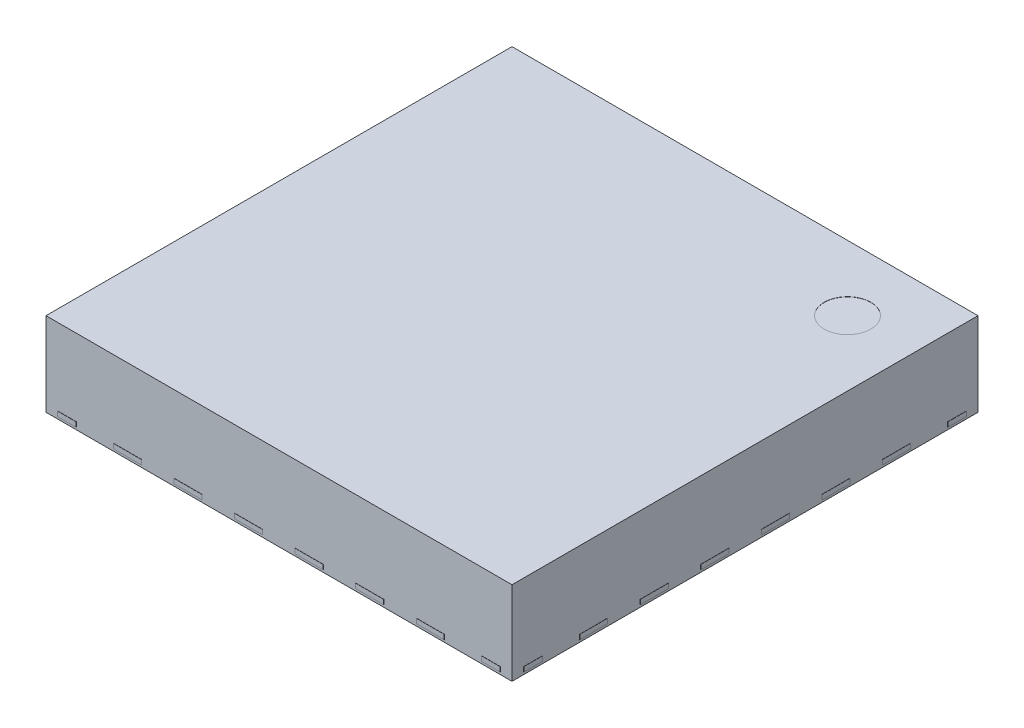
from build123d import *

# Parameters (mm, degrees)
EXTRUDE1_START           = 0.002
SKETCH1_W                = 5
SKETCH1_H                = 5
EXTRUDE1_DEPTH           = 0.898
EXTRUDE2_DEPTH           = 0.002
EXTRUDE3_DEPTH           = 0.002
EXTRUDE5_START           = -0.025
SKETCH6_W                = 0.3
SKETCH6_H                = 0.002
EXTRUDE5_DEPTH           = 0.05
EXTRUDE6_START           = 0.025
SKETCH7_W                = 0.002
SKETCH7_H                = 0.3
EXTRUDE6_DEPTH           = 0.05
LPATTERN1_COUNT          = 4
LPATTERN1_PITCH          = 0.65
LPATTERN1_COL_COUNT      = 5
LPATTERN1_COL_PITCH      = 0.65
LPATTERN2_COUNT          = 4
LPATTERN2_PITCH          = 0.65
LPATTERN2_COL_COUNT      = 5
LPATTERN2_COL_PITCH      = 0.65
MIRROR1_COPY_1_DEPTH     = 0.002
MIRROR1_COPY_2_DEPTH     = 0.002
MIRROR1_COPY_3_DEPTH     = 0.002
MIRROR1_START            = -0.025
MIRROR1_COPY_4_SKETCH_W  = 0.3
MIRROR1_COPY_4_SKETCH_H  = 0.002
MIRROR1_COPY_4_DEPTH     = 0.05
MIRROR1_COPY_5_SKETCH_W  = 0.3
MIRROR1_COPY_5_SKETCH_H  = 0.002
MIRROR1_COPY_5_DEPTH     = 0.05
MIRROR1_COPY_6_SKETCH_W  = 0.3
MIRROR1_COPY_6_SKETCH_H  = 0.002
MIRROR1_COPY_6_DEPTH     = 0.05
MIRROR1_COPY_7_DEPTH     = 0.002
MIRROR1_COPY_8_DEPTH     = 0.002
MIRROR1_COPY_9_DEPTH     = 0.002
MIRROR1_COPY_10_DEPTH    = 0.002
MIRROR1_COPY_11_SKETCH_W = 0.3
MIRROR1_COPY_11_SKETCH_H = 0.002
MIRROR1_COPY_11_DEPTH    = 0.05
MIRROR1_COPY_12_SKETCH_W = 0.3
MIRROR1_COPY_12_SKETCH_H = 0.002
MIRROR1_COPY_12_DEPTH    = 0.05
MIRROR1_COPY_13_SKETCH_W = 0.3
MIRROR1_COPY_13_SKETCH_H = 0.002
MIRROR1_COPY_13_DEPTH    = 0.05
MIRROR1_COPY_14_SKETCH_W = 0.3
MIRROR1_COPY_14_SKETCH_H = 0.002
MIRROR1_COPY_14_DEPTH    = 0.05
MIRROR2_COPY_1_DEPTH     = 0.002
MIRROR2_COPY_2_DEPTH     = 0.002
MIRROR2_COPY_3_DEPTH     = 0.002
MIRROR2_START            = 0.025
MIRROR2_COPY_4_SKETCH_W  = 0.002
MIRROR2_COPY_4_SKETCH_H  = 0.3
MIRROR2_COPY_4_DEPTH     = 0.05
MIRROR2_COPY_5_SKETCH_W  = 0.002
MIRROR2_COPY_5_SKETCH_H  = 0.3
MIRROR2_COPY_5_DEPTH     = 0.05
MIRROR2_COPY_6_SKETCH_W  = 0.002
MIRROR2_COPY_6_SKETCH_H  = 0.3
MIRROR2_COPY_6_DEPTH     = 0.05
MIRROR2_COPY_7_DEPTH     = 0.002
MIRROR2_COPY_8_DEPTH     = 0.002
MIRROR2_COPY_9_DEPTH     = 0.002
MIRROR2_COPY_10_DEPTH    = 0.002
MIRROR2_COPY_11_SKETCH_W = 0.002
MIRROR2_COPY_11_SKETCH_H = 0.3
MIRROR2_COPY_11_DEPTH    = 0.05
MIRROR2_COPY_12_SKETCH_W = 0.002
MIRROR2_COPY_12_SKETCH_H = 0.3
MIRROR2_COPY_12_DEPTH    = 0.05
MIRROR2_COPY_13_SKETCH_W = 0.002
MIRROR2_COPY_13_SKETCH_H = 0.3
MIRROR2_COPY_13_DEPTH    = 0.05
MIRROR2_COPY_14_SKETCH_W = 0.002
MIRROR2_COPY_14_SKETCH_H = 0.3
MIRROR2_COPY_14_DEPTH    = 0.05
EXTRUDE4_DEPTH           = 0.002
SKETCH5_R                = 0.25
CUT_EXTRUDE1_DEPTH       = 0.002
SKETCH11_W               = 0.05
SKETCH11_H               = 0.05
CUT_EXTRUDE5_DEPTH       = 0.002
SKETCH13_W               = 0.05
SKETCH13_H               = 0.05
CUT_EXTRUDE6_DEPTH       = 0.002


with BuildPart() as part:
    # Sketch1 → Extrude1 (new body)
    with BuildSketch(Plane(origin=(0, 0, 0), x_dir=(1, 0, 0), z_dir=(0, 1, 0)).offset(EXTRUDE1_START)):
        Rectangle(SKETCH1_W, SKETCH1_H)
    extrude(amount=EXTRUDE1_DEPTH)

    # Sketch2 → Extrude2 (add)
    with BuildSketch(Plane(origin=(0, 0, 0), x_dir=(1, 0, 0), z_dir=(0, 1, 0))):
        with BuildLine():
            Line((0.175, 2.4425), (0.475, 2.4425))
            Line((0.475, 2.4425), (0.475, 2.255))
            ThreePointArc((0.475, 2.255), (0.325, 2.105), (0.175, 2.255))
            Line((0.175, 2.255), (0.175, 2.4425))
        make_face()
    extrude2 = extrude(amount=EXTRUDE2_DEPTH)

    # Sketch3 → Extrude3 (add)
    with BuildSketch(Plane(origin=(0, 0, 0), x_dir=(1, 0, 0), z_dir=(0, 1, 0))):
        with BuildLine():
            Line((-2.4425, 0.175), (-2.1425, 0.175))
            ThreePointArc((-2.1425, 0.175), (-1.9925, 0.325), (-2.1425, 0.475))
            Line((-2.1425, 0.475), (-2.4425, 0.475))
            Line((-2.4425, 0.475), (-2.4425, 0.175))
        make_face()
    extrude3 = extrude(amount=EXTRUDE3_DEPTH)

    # Sketch6 → Extrude5 (add)
    with BuildSketch(Plane(origin=(0, 0.002, 0), x_dir=(-1, 0, 0), z_dir=(0, -1, 0)).offset(EXTRUDE5_START)):
        with Locations((-0.325, 2.501)):
            Rectangle(SKETCH6_W, SKETCH6_H)
    extrude5 = extrude(amount=-EXTRUDE5_DEPTH)

    # Sketch7 → Extrude6 (add)
    with BuildSketch(Plane(origin=(0, 0.002, 0), x_dir=(1, 0, 0), z_dir=(0, 1, 0)).offset(EXTRUDE6_START)):
        with Locations((-2.501, 0.325)):
            Rectangle(SKETCH7_W, SKETCH7_H)
    extrude6 = extrude(amount=EXTRUDE6_DEPTH)

    # LPattern1: Extrude2, Extrude5 ×4
    with Locations(*[(i * LPATTERN1_PITCH, 0, 0) for i in range(1, LPATTERN1_COUNT)]):
        add(extrude2)
        add(extrude5)

    # LPattern1 col: Extrude2, Extrude5 ×5
    with Locations(*[(-i * LPATTERN1_COL_PITCH, 0, 0) for i in range(1, LPATTERN1_COL_COUNT)]):
        add(extrude2)
        add(extrude5)

    # LPattern2: Extrude3, Extrude6 ×4
    with Locations(*[(0, 0, -i * LPATTERN2_PITCH) for i in range(1, LPATTERN2_COUNT)]):
        add(extrude3)
        add(extrude6)

    # LPattern2 col: Extrude3, Extrude6 ×5
    with Locations(*[(0, 0, i * LPATTERN2_COL_PITCH) for i in range(1, LPATTERN2_COL_COUNT)]):
        add(extrude3)
        add(extrude6)

    # Mirror1: Extrude2, Extrude5 across plane
    add(extrude2.mirror(Plane.XY))
    add(extrude5.mirror(Plane.XY))

    # Mirror1 copy 1 sketch → Mirror1 copy 1 (add)
    with BuildSketch(Plane(origin=(0.65, 0, 0), x_dir=(1, 0, 0), z_dir=(0, 1, 0))):
        with BuildLine():
            Line((0.175, -2.4425), (0.475, -2.4425))
            Line((0.475, -2.4425), (0.475, -2.255))
            ThreePointArc((0.475, -2.255), (0.325, -2.105), (0.175, -2.255))
            Line((0.175, -2.255), (0.175, -2.4425))
        make_face()
    extrude(amount=MIRROR1_COPY_1_DEPTH)

    # Mirror1 copy 2 sketch → Mirror1 copy 2 (add)
    with BuildSketch(Plane(origin=(1.3, 0, 0), x_dir=(1, 0, 0), z_dir=(0, 1, 0))):
        with BuildLine():
            Line((0.175, -2.4425), (0.475, -2.4425))
            Line((0.475, -2.4425), (0.475, -2.255))
            ThreePointArc((0.475, -2.255), (0.325, -2.105), (0.175, -2.255))
            Line((0.175, -2.255), (0.175, -2.4425))
        make_face()
    extrude(amount=MIRROR1_COPY_2_DEPTH)

    # Mirror1 copy 3 sketch → Mirror1 copy 3 (add)
    with BuildSketch(Plane(origin=(1.95, 0, 0), x_dir=(1, 0, 0), z_dir=(0, 1, 0))):
        with BuildLine():
            Line((0.175, -2.4425), (0.475, -2.4425))
            Line((0.475, -2.4425), (0.475, -2.255))
            ThreePointArc((0.475, -2.255), (0.325, -2.105), (0.175, -2.255))
            Line((0.175, -2.255), (0.175, -2.4425))
        make_face()
    extrude(amount=MIRROR1_COPY_3_DEPTH)

    # Mirror1 copy 4 sketch → Mirror1 copy 4 (add)
    with BuildSketch(Plane(origin=(0.65, 0.002, 0), x_dir=(-1, 0, 0), z_dir=(0, -1, 0)).offset(MIRROR1_START)):
        with Locations((-0.325, -2.501)):
            Rectangle(MIRROR1_COPY_4_SKETCH_W, MIRROR1_COPY_4_SKETCH_H)
    extrude(amount=-MIRROR1_COPY_4_DEPTH)

    # Mirror1 copy 5 sketch → Mirror1 copy 5 (add)
    with BuildSketch(Plane(origin=(1.3, 0.002, 0), x_dir=(-1, 0, 0), z_dir=(0, -1, 0)).offset(MIRROR1_START)):
        with Locations((-0.325, -2.501)):
            Rectangle(MIRROR1_COPY_5_SKETCH_W, MIRROR1_COPY_5_SKETCH_H)
    extrude(amount=-MIRROR1_COPY_5_DEPTH)

    # Mirror1 copy 6 sketch → Mirror1 copy 6 (add)
    with BuildSketch(Plane(origin=(1.95, 0.002, 0), x_dir=(-1, 0, 0), z_dir=(0, -1, 0)).offset(MIRROR1_START)):
        with Locations((-0.325, -2.501)):
            Rectangle(MIRROR1_COPY_6_SKETCH_W, MIRROR1_COPY_6_SKETCH_H)
    extrude(amount=-MIRROR1_COPY_6_DEPTH)

    # Mirror1 copy 7 sketch → Mirror1 copy 7 (add)
    with BuildSketch(Plane(origin=(-0.65, 0, 0), x_dir=(1, 0, 0), z_dir=(0, 1, 0))):
        with BuildLine():
            Line((0.175, -2.4425), (0.475, -2.4425))
            Line((0.475, -2.4425), (0.475, -2.255))
            ThreePointArc((0.475, -2.255), (0.325, -2.105), (0.175, -2.255))
            Line((0.175, -2.255), (0.175, -2.4425))
        make_face()
    extrude(amount=MIRROR1_COPY_7_DEPTH)

    # Mirror1 copy 8 sketch → Mirror1 copy 8 (add)
    with BuildSketch(Plane(origin=(-1.3, 0, 0), x_dir=(1, 0, 0), z_dir=(0, 1, 0))):
        with BuildLine():
            Line((0.175, -2.4425), (0.475, -2.4425))
            Line((0.475, -2.4425), (0.475, -2.255))
            ThreePointArc((0.475, -2.255), (0.325, -2.105), (0.175, -2.255))
            Line((0.175, -2.255), (0.175, -2.4425))
        make_face()
    extrude(amount=MIRROR1_COPY_8_DEPTH)

    # Mirror1 copy 9 sketch → Mirror1 copy 9 (add)
    with BuildSketch(Plane(origin=(-1.95, 0, 0), x_dir=(1, 0, 0), z_dir=(0, 1, 0))):
        with BuildLine():
            Line((0.175, -2.4425), (0.475, -2.4425))
            Line((0.475, -2.4425), (0.475, -2.255))
            ThreePointArc((0.475, -2.255), (0.325, -2.105), (0.175, -2.255))
            Line((0.175, -2.255), (0.175, -2.4425))
        make_face()
    extrude(amount=MIRROR1_COPY_9_DEPTH)

    # Mirror1 copy 10 sketch → Mirror1 copy 10 (add)
    with BuildSketch(Plane(origin=(-2.6, 0, 0), x_dir=(1, 0, 0), z_dir=(0, 1, 0))):
        with BuildLine():
            Line((0.175, -2.4425), (0.475, -2.4425))
            Line((0.475, -2.4425), (0.475, -2.255))
            ThreePointArc((0.475, -2.255), (0.325, -2.105), (0.175, -2.255))
            Line((0.175, -2.255), (0.175, -2.4425))
        make_face()
    extrude(amount=MIRROR1_COPY_10_DEPTH)

    # Mirror1 copy 11 sketch → Mirror1 copy 11 (add)
    with BuildSketch(Plane(origin=(-0.65, 0.002, 0), x_dir=(-1, 0, 0), z_dir=(0, -1, 0)).offset(MIRROR1_START)):
        with Locations((-0.325, -2.501)):
            Rectangle(MIRROR1_COPY_11_SKETCH_W, MIRROR1_COPY_11_SKETCH_H)
    extrude(amount=-MIRROR1_COPY_11_DEPTH)

    # Mirror1 copy 12 sketch → Mirror1 copy 12 (add)
    with BuildSketch(Plane(origin=(-1.3, 0.002, 0), x_dir=(-1, 0, 0), z_dir=(0, -1, 0)).offset(MIRROR1_START)):
        with Locations((-0.325, -2.501)):
            Rectangle(MIRROR1_COPY_12_SKETCH_W, MIRROR1_COPY_12_SKETCH_H)
    extrude(amount=-MIRROR1_COPY_12_DEPTH)

    # Mirror1 copy 13 sketch → Mirror1 copy 13 (add)
    with BuildSketch(Plane(origin=(-1.95, 0.002, 0), x_dir=(-1, 0, 0), z_dir=(0, -1, 0)).offset(MIRROR1_START)):
        with Locations((-0.325, -2.501)):
            Rectangle(MIRROR1_COPY_13_SKETCH_W, MIRROR1_COPY_13_SKETCH_H)
    extrude(amount=-MIRROR1_COPY_13_DEPTH)

    # Mirror1 copy 14 sketch → Mirror1 copy 14 (add)
    with BuildSketch(Plane(origin=(-2.6, 0.002, 0), x_dir=(-1, 0, 0), z_dir=(0, -1, 0)).offset(MIRROR1_START)):
        with Locations((-0.325, -2.501)):
            Rectangle(MIRROR1_COPY_14_SKETCH_W, MIRROR1_COPY_14_SKETCH_H)
    extrude(amount=-MIRROR1_COPY_14_DEPTH)

    # Mirror2: Extrude3, Extrude6 across plane
    add(extrude3.mirror(Plane(origin=(0, 0, 0), x_dir=(0, 0, 1), z_dir=(1, 0, 0))))
    add(extrude6.mirror(Plane(origin=(0, 0, 0), x_dir=(0, 0, 1), z_dir=(1, 0, 0))))

    # Mirror2 copy 1 sketch → Mirror2 copy 1 (add)
    with BuildSketch(Plane(origin=(0, 0, -0.65), x_dir=(-1, 0, 0), z_dir=(0, 1, 0))):
        with BuildLine():
            Line((-2.4425, -0.175), (-2.1425, -0.175))
            ThreePointArc((-2.1425, -0.175), (-1.9925, -0.325), (-2.1425, -0.475))
            Line((-2.1425, -0.475), (-2.4425, -0.475))
            Line((-2.4425, -0.475), (-2.4425, -0.175))
        make_face()
    extrude(amount=MIRROR2_COPY_1_DEPTH)

    # Mirror2 copy 2 sketch → Mirror2 copy 2 (add)
    with BuildSketch(Plane(origin=(0, 0, -1.3), x_dir=(-1, 0, 0), z_dir=(0, 1, 0))):
        with BuildLine():
            Line((-2.4425, -0.175), (-2.1425, -0.175))
            ThreePointArc((-2.1425, -0.175), (-1.9925, -0.325), (-2.1425, -0.475))
            Line((-2.1425, -0.475), (-2.4425, -0.475))
            Line((-2.4425, -0.475), (-2.4425, -0.175))
        make_face()
    extrude(amount=MIRROR2_COPY_2_DEPTH)

    # Mirror2 copy 3 sketch → Mirror2 copy 3 (add)
    with BuildSketch(Plane(origin=(0, 0, -1.95), x_dir=(-1, 0, 0), z_dir=(0, 1, 0))):
        with BuildLine():
            Line((-2.4425, -0.175), (-2.1425, -0.175))
            ThreePointArc((-2.1425, -0.175), (-1.9925, -0.325), (-2.1425, -0.475))
            Line((-2.1425, -0.475), (-2.4425, -0.475))
            Line((-2.4425, -0.475), (-2.4425, -0.175))
        make_face()
    extrude(amount=MIRROR2_COPY_3_DEPTH)

    # Mirror2 copy 4 sketch → Mirror2 copy 4 (add)
    with BuildSketch(Plane(origin=(0, 0.002, -0.65), x_dir=(-1, 0, 0), z_dir=(0, 1, 0)).offset(MIRROR2_START)):
        with Locations((-2.501, -0.325)):
            Rectangle(MIRROR2_COPY_4_SKETCH_W, MIRROR2_COPY_4_SKETCH_H)
    extrude(amount=MIRROR2_COPY_4_DEPTH)

    # Mirror2 copy 5 sketch → Mirror2 copy 5 (add)
    with BuildSketch(Plane(origin=(0, 0.002, -1.3), x_dir=(-1, 0, 0), z_dir=(0, 1, 0)).offset(MIRROR2_START)):
        with Locations((-2.501, -0.325)):
            Rectangle(MIRROR2_COPY_5_SKETCH_W, MIRROR2_COPY_5_SKETCH_H)
    extrude(amount=MIRROR2_COPY_5_DEPTH)

    # Mirror2 copy 6 sketch → Mirror2 copy 6 (add)
    with BuildSketch(Plane(origin=(0, 0.002, -1.95), x_dir=(-1, 0, 0), z_dir=(0, 1, 0)).offset(MIRROR2_START)):
        with Locations((-2.501, -0.325)):
            Rectangle(MIRROR2_COPY_6_SKETCH_W, MIRROR2_COPY_6_SKETCH_H)
    extrude(amount=MIRROR2_COPY_6_DEPTH)

    # Mirror2 copy 7 sketch → Mirror2 copy 7 (add)
    with BuildSketch(Plane(origin=(0, 0, 0.65), x_dir=(-1, 0, 0), z_dir=(0, 1, 0))):
        with BuildLine():
            Line((-2.4425, -0.175), (-2.1425, -0.175))
            ThreePointArc((-2.1425, -0.175), (-1.9925, -0.325), (-2.1425, -0.475))
            Line((-2.1425, -0.475), (-2.4425, -0.475))
            Line((-2.4425, -0.475), (-2.4425, -0.175))
        make_face()
    extrude(amount=MIRROR2_COPY_7_DEPTH)

    # Mirror2 copy 8 sketch → Mirror2 copy 8 (add)
    with BuildSketch(Plane(origin=(0, 0, 1.3), x_dir=(-1, 0, 0), z_dir=(0, 1, 0))):
        with BuildLine():
            Line((-2.4425, -0.175), (-2.1425, -0.175))
            ThreePointArc((-2.1425, -0.175), (-1.9925, -0.325), (-2.1425, -0.475))
            Line((-2.1425, -0.475), (-2.4425, -0.475))
            Line((-2.4425, -0.475), (-2.4425, -0.175))
        make_face()
    extrude(amount=MIRROR2_COPY_8_DEPTH)

    # Mirror2 copy 9 sketch → Mirror2 copy 9 (add)
    with BuildSketch(Plane(origin=(0, 0, 1.95), x_dir=(-1, 0, 0), z_dir=(0, 1, 0))):
        with BuildLine():
            Line((-2.4425, -0.175), (-2.1425, -0.175))
            ThreePointArc((-2.1425, -0.175), (-1.9925, -0.325), (-2.1425, -0.475))
            Line((-2.1425, -0.475), (-2.4425, -0.475))
            Line((-2.4425, -0.475), (-2.4425, -0.175))
        make_face()
    extrude(amount=MIRROR2_COPY_9_DEPTH)

    # Mirror2 copy 10 sketch → Mirror2 copy 10 (add)
    with BuildSketch(Plane(origin=(0, 0, 2.6), x_dir=(-1, 0, 0), z_dir=(0, 1, 0))):
        with BuildLine():
            Line((-2.4425, -0.175), (-2.1425, -0.175))
            ThreePointArc((-2.1425, -0.175), (-1.9925, -0.325), (-2.1425, -0.475))
            Line((-2.1425, -0.475), (-2.4425, -0.475))
            Line((-2.4425, -0.475), (-2.4425, -0.175))
        make_face()
    extrude(amount=MIRROR2_COPY_10_DEPTH)

    # Mirror2 copy 11 sketch → Mirror2 copy 11 (add)
    with BuildSketch(Plane(origin=(0, 0.002, 0.65), x_dir=(-1, 0, 0), z_dir=(0, 1, 0)).offset(MIRROR2_START)):
        with Locations((-2.501, -0.325)):
            Rectangle(MIRROR2_COPY_11_SKETCH_W, MIRROR2_COPY_11_SKETCH_H)
    extrude(amount=MIRROR2_COPY_11_DEPTH)

    # Mirror2 copy 12 sketch → Mirror2 copy 12 (add)
    with BuildSketch(Plane(origin=(0, 0.002, 1.3), x_dir=(-1, 0, 0), z_dir=(0, 1, 0)).offset(MIRROR2_START)):
        with Locations((-2.501, -0.325)):
            Rectangle(MIRROR2_COPY_12_SKETCH_W, MIRROR2_COPY_12_SKETCH_H)
    extrude(amount=MIRROR2_COPY_12_DEPTH)

    # Mirror2 copy 13 sketch → Mirror2 copy 13 (add)
    with BuildSketch(Plane(origin=(0, 0.002, 1.95), x_dir=(-1, 0, 0), z_dir=(0, 1, 0)).offset(MIRROR2_START)):
        with Locations((-2.501, -0.325)):
            Rectangle(MIRROR2_COPY_13_SKETCH_W, MIRROR2_COPY_13_SKETCH_H)
    extrude(amount=MIRROR2_COPY_13_DEPTH)

    # Mirror2 copy 14 sketch → Mirror2 copy 14 (add)
    with BuildSketch(Plane(origin=(0, 0.002, 2.6), x_dir=(-1, 0, 0), z_dir=(0, 1, 0)).offset(MIRROR2_START)):
        with Locations((-2.501, -0.325)):
            Rectangle(MIRROR2_COPY_14_SKETCH_W, MIRROR2_COPY_14_SKETCH_H)
    extrude(amount=MIRROR2_COPY_14_DEPTH)

    # Sketch4 → Extrude4 (add)
    with BuildSketch(Plane.XZ.offset(-0.002)):
        Polygon((-1.723223305, 1.9), (1.723, 1.9), (1.9, 1.723), (1.9, -1.723223305), (2.176776695, -2), (2, -2.176776695), (1.723223305, -1.9), (-1.723223305, -1.9), (-2, -2.176776695), (-2.176776695, -2), (-1.9, -1.723223305), (-1.9, 1.723223305), (-2.176776695, 2), (-2, 2.176776695), align=None)
    extrude(amount=EXTRUDE4_DEPTH)

    # Sketch5 → Cut-Extrude1 (cut)
    with BuildSketch(Plane(origin=(0, 0.9, 0), x_dir=(1, 0, 0), z_dir=(0, 1, 0))):
        with Locations(Location((1.8, 1.8, 0), (0, 0, 270))):
            Circle(SKETCH5_R)
    extrude(amount=-CUT_EXTRUDE1_DEPTH, mode=Mode.SUBTRACT)

    # Sketch11 → Cut-Extrude5 (cut)
    with BuildSketch(Plane(origin=(0, 0, -2.502), x_dir=(-1, 0, 0), z_dir=(0, 0, -1))):
        with Locations((-2.4, 0.052)):
            Rectangle(SKETCH11_W, SKETCH11_H)
        with Locations((-2.15, 0.052)):
            Rectangle(SKETCH11_W, SKETCH11_H)
        with Locations((2.15, 0.052)):
            Rectangle(SKETCH11_W, SKETCH11_H)
        with Locations((2.4, 0.052)):
            Rectangle(SKETCH11_W, SKETCH11_H)
    cut_extrude5 = extrude(amount=-CUT_EXTRUDE5_DEPTH, mode=Mode.SUBTRACT)

    # Mirror3: Cut-Extrude5 across plane
    add(cut_extrude5.mirror(Plane.XY), mode=Mode.SUBTRACT)

    # Sketch13 → Cut-Extrude6 (cut)
    with BuildSketch(Plane(origin=(2.502, 0, 0), x_dir=(0, 0, -1), z_dir=(1, 0, 0))):
        with Locations((2.15, 0.052)):
            Rectangle(SKETCH13_W, SKETCH13_H)
        with Locations((2.4, 0.052)):
            Rectangle(SKETCH13_W, SKETCH13_H)
        with Locations((-2.4, 0.052)):
            Rectangle(SKETCH13_W, SKETCH13_H)
        with Locations((-2.15, 0.052)):
            Rectangle(SKETCH13_W, SKETCH13_H)
    cut_extrude6 = extrude(amount=-CUT_EXTRUDE6_DEPTH, mode=Mode.SUBTRACT)

    # Mirror4: Cut-Extrude6 across plane
    add(cut_extrude6.mirror(Plane(origin=(0, 0, 0), x_dir=(0, 0, 1), z_dir=(1, 0, 0))), mode=Mode.SUBTRACT)


solid = part.part
